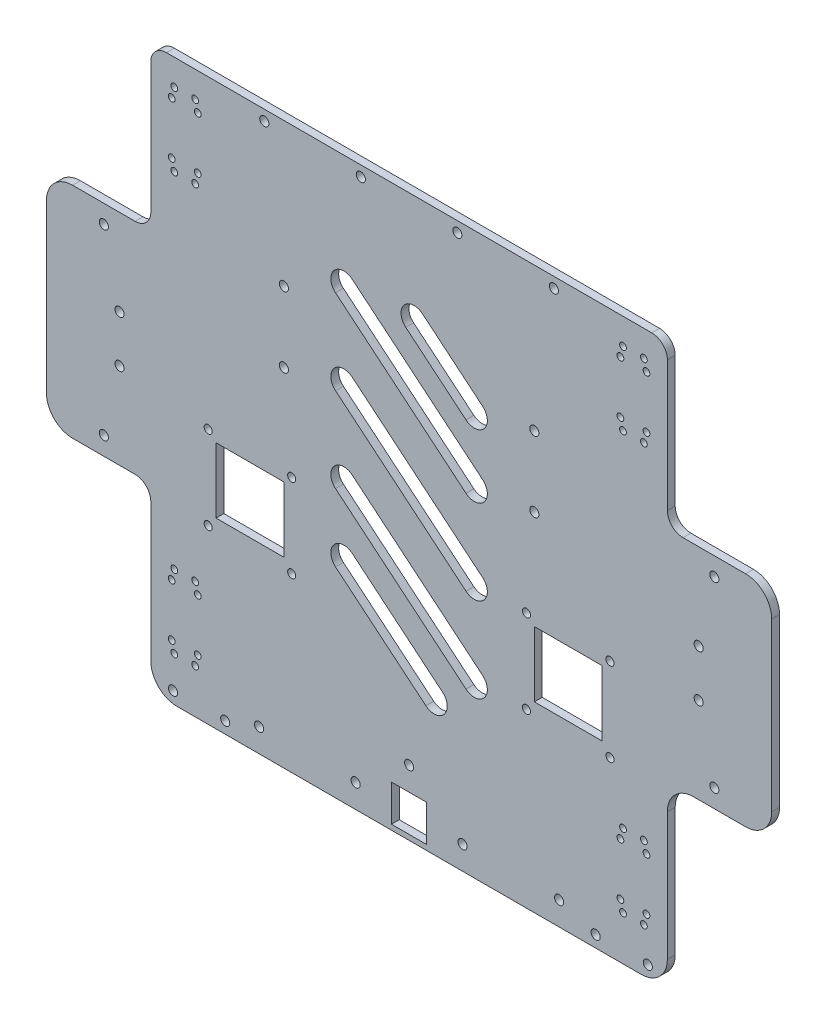
from build123d import *

# Parameters (mm, degrees)
SKETCH_1_W           = 278
SKETCH_1_H           = 210
EXTRUDE_1_DEPTH      = 3
SKETCH_2_W           = 40
SKETCH_2_H           = 62
SKETCH_2_H_2         = 64
CUT_EXTRUDE_1_DEPTH  = 3
SKETCH_3_R           = 1.2
CUT_EXTRUDE_2_DEPTH  = 3
SKETCH_5_R           = 1.3
CUT_EXTRUDE_4_DEPTH  = 3
SKETCH_7_R           = 1.75
CUT_EXTRUDE_5_DEPTH  = 3
SKETCH_8_W           = 198
SKETCH_8_H           = 5
EXTRUDE_2_DEPTH      = 3
SKETCH_9_R           = 1.75
SKETCH_9_W           = 13.5
SKETCH_9_H           = 14
CUT_EXTRUDE_6_DEPTH  = 3
SKETCH_11_R          = 1.75
CUT_EXTRUDE_7_DEPTH  = 3
SKETCH_12_R          = 1.55
SKETCH_12_W          = 26
SKETCH_12_H          = 25
CUT_EXTRUDE_8_DEPTH  = 3
FILLET_1_R           = 6
FILLET_2_R           = 6
FILLET_3_R           = 6
FILLET_4_R           = 10
FILLET_5_R           = 10
FILLET_6_R           = 6
FILLET_7_R           = 6
FILLET_8_R           = 10
FILLET_9_R           = 10
FILLET_10_R          = 10
FILLET_11_R          = 10
SKETCH_17_R          = 1.75
CUT_EXTRUDE_9_DEPTH  = 3
SKETCH_18_R          = 1.75
CUT_EXTRUDE_10_DEPTH = 3
SKETCH_22_R          = 1.75
CUT_EXTRUDE_11_DEPTH = 3
FILLET_12_R          = 10
SKETCH_23_R          = 1.3
CUT_EXTRUDE_12_DEPTH = 10
SKETCH_24_R          = 1.3
CUT_EXTRUDE_13_DEPTH = 10
SKETCH_25_R          = 1.75
CUT_EXTRUDE_14_DEPTH = 3
CUT_EXTRUDE_15_DEPTH = 178.285081155


with BuildPart() as part:
    # 草图1 → 凸台-拉伸1 (new body)
    with BuildSketch(Plane.XY):
        Rectangle(SKETCH_1_W, SKETCH_1_H)
    extrude(amount=EXTRUDE_1_DEPTH)

    # 草图2 → 切除-拉伸1 (cut)
    with BuildSketch(Plane.XY.offset(3)):
        with Locations((-119, 74)):
            Rectangle(SKETCH_2_W, SKETCH_2_H)
        with Locations((119, 74)):
            Rectangle(SKETCH_2_W, SKETCH_2_H)
        with Locations((-119, -73)):
            Rectangle(SKETCH_2_W, SKETCH_2_H_2)
        with Locations((119, -73)):
            Rectangle(SKETCH_2_W, SKETCH_2_H_2)
    extrude(amount=-CUT_EXTRUDE_1_DEPTH, mode=Mode.SUBTRACT)

    # 草图3 → 切除-拉伸2 (cut)
    with BuildSketch(Plane.XY.offset(3)):
        with Locations((-90, 95)):
            Circle(SKETCH_3_R)
        with Locations((-90, 67)):
            Circle(SKETCH_3_R)
        with Locations((-82, 95)):
            Circle(SKETCH_3_R)
        with Locations((-82, 67)):
            Circle(SKETCH_3_R)
        with Locations((82, 95)):
            Circle(SKETCH_3_R)
        with Locations((90, 95)):
            Circle(SKETCH_3_R)
        with Locations((90, 67)):
            Circle(SKETCH_3_R)
        with Locations((82, 67)):
            Circle(SKETCH_3_R)
    extrude(amount=-CUT_EXTRUDE_2_DEPTH, mode=Mode.SUBTRACT)

    # 草图5 → 切除-拉伸4 (cut)
    with BuildSketch(Plane.XY.offset(3)):
        with Locations((-90, -65)):
            Circle(SKETCH_5_R)
        with Locations((-90, -93)):
            Circle(SKETCH_5_R)
        with Locations((-82, -65)):
            Circle(SKETCH_5_R)
        with Locations((-82, -93)):
            Circle(SKETCH_5_R)
        with Locations((90, -65)):
            Circle(SKETCH_5_R)
        with Locations((82, -65)):
            Circle(SKETCH_5_R)
        with Locations((82, -93)):
            Circle(SKETCH_5_R)
        with Locations((90, -93)):
            Circle(SKETCH_5_R)
    extrude(amount=-CUT_EXTRUDE_4_DEPTH, mode=Mode.SUBTRACT)

    # 草图7 → 切除-拉伸5 (cut)
    with BuildSketch(Plane.XY.offset(3)):
        with Locations((-57.5, -101)):
            Circle(SKETCH_7_R)
        with Locations((-20.5, -101)):
            Circle(SKETCH_7_R)
        with Locations((20.5, -101)):
            Circle(SKETCH_7_R)
        with Locations((57.5, -101)):
            Circle(SKETCH_7_R)
    extrude(amount=-CUT_EXTRUDE_5_DEPTH, mode=Mode.SUBTRACT)

    # 草图8 → 凸台-拉伸2 (add)
    with BuildSketch(Plane.XY.offset(3)):
        with Locations((0, -107.5)):
            Rectangle(SKETCH_8_W, SKETCH_8_H)
    extrude(amount=-EXTRUDE_2_DEPTH)

    # 草图9 → 切除-拉伸6 (cut)
    with BuildSketch(Plane.XY.offset(3)):
        with Locations((0, -85)):
            Circle(SKETCH_9_R)
        with Locations((0, -101)):
            Rectangle(SKETCH_9_W, SKETCH_9_H)
    extrude(amount=-CUT_EXTRUDE_6_DEPTH, mode=Mode.SUBTRACT)

    # 草图11 → 切除-拉伸7 (cut)
    with BuildSketch(Plane.XY.offset(3)):
        with Locations((-55.5, 101)):
            Circle(SKETCH_11_R)
        with Locations((-18.5, 101)):
            Circle(SKETCH_11_R)
        with Locations((18.5, 101)):
            Circle(SKETCH_11_R)
        with Locations((55.5, 101)):
            Circle(SKETCH_11_R)
    extrude(amount=-CUT_EXTRUDE_7_DEPTH, mode=Mode.SUBTRACT)

    # 草图12 → 切除-拉伸8 (cut)
    with BuildSketch(Plane.XY.offset(3)):
        with Locations((-77, -12)):
            Circle(SKETCH_12_R)
        with Locations((-45, -12)):
            Circle(SKETCH_12_R)
        with Locations((-77, -44)):
            Circle(SKETCH_12_R)
        with Locations((-45, -44)):
            Circle(SKETCH_12_R)
        with Locations((45, -12)):
            Circle(SKETCH_12_R)
        with Locations((77, -12)):
            Circle(SKETCH_12_R)
        with Locations((45, -44)):
            Circle(SKETCH_12_R)
        with Locations((77, -44)):
            Circle(SKETCH_12_R)
        with Locations((-61, -27.5)):
            Rectangle(SKETCH_12_W, SKETCH_12_H)
        with Locations((61, -27.5)):
            Rectangle(SKETCH_12_W, SKETCH_12_H)
    extrude(amount=-CUT_EXTRUDE_8_DEPTH, mode=Mode.SUBTRACT)

    # 圆角1
    fillet_1_edges = [part.edges().sort_by_distance(p)[0] for p in [
        (-99, 105, 1.5),
    ]]
    fillet(fillet_1_edges, radius=FILLET_1_R)

    # 圆角2
    fillet_2_edges = [part.edges().sort_by_distance(p)[0] for p in [
        (99, 105, 1.5),
    ]]
    fillet(fillet_2_edges, radius=FILLET_2_R)

    # 圆角3
    fillet_3_edges = [part.edges().sort_by_distance(p)[0] for p in [
        (-99, 43, 1.5),
    ]]
    fillet(fillet_3_edges, radius=FILLET_3_R)

    # 圆角4
    fillet_4_edges = [part.edges().sort_by_distance(p)[0] for p in [
        (-139, 43, 1.5),
    ]]
    fillet(fillet_4_edges, radius=FILLET_4_R)

    # 圆角5
    fillet_5_edges = [part.edges().sort_by_distance(p)[0] for p in [
        (-139, -41, 1.5),
    ]]
    fillet(fillet_5_edges, radius=FILLET_5_R)

    # 圆角6
    fillet_6_edges = [part.edges().sort_by_distance(p)[0] for p in [
        (-99, -41, 1.5),
    ]]
    fillet(fillet_6_edges, radius=FILLET_6_R)

    # 圆角7
    fillet_7_edges = [part.edges().sort_by_distance(p)[0] for p in [
        (99, 43, 1.5),
    ]]
    fillet(fillet_7_edges, radius=FILLET_7_R)

    # 圆角8
    fillet_8_edges = [part.edges().sort_by_distance(p)[0] for p in [
        (139, 43, 1.5),
    ]]
    fillet(fillet_8_edges, radius=FILLET_8_R)

    # 圆角9
    fillet_9_edges = [part.edges().sort_by_distance(p)[0] for p in [
        (139, -41, 1.5),
    ]]
    fillet(fillet_9_edges, radius=FILLET_9_R)

    # 圆角10
    fillet_10_edges = [part.edges().sort_by_distance(p)[0] for p in [
        (-99, -110, 1.5),
    ]]
    fillet(fillet_10_edges, radius=FILLET_10_R)

    # 圆角11
    fillet_11_edges = [part.edges().sort_by_distance(p)[0] for p in [
        (99, -110, 1.5),
    ]]
    fillet(fillet_11_edges, radius=FILLET_11_R)

    # 草图17 → 切除-拉伸9 (cut)
    with BuildSketch(Plane.XY.offset(3)):
        with Locations((-117, 36)):
            Circle(SKETCH_17_R)
        with Locations((-111, 10)):
            Circle(SKETCH_17_R)
        with Locations((-111, -8)):
            Circle(SKETCH_17_R)
        with Locations((-117, -34)):
            Circle(SKETCH_17_R)
    extrude(amount=-CUT_EXTRUDE_9_DEPTH, mode=Mode.SUBTRACT)

    # 草图18 → 切除-拉伸10 (cut)
    with BuildSketch(Plane.XY.offset(3)):
        with Locations((111, 10)):
            Circle(SKETCH_18_R)
        with Locations((117, 36)):
            Circle(SKETCH_18_R)
        with Locations((111, -8)):
            Circle(SKETCH_18_R)
        with Locations((117, -34)):
            Circle(SKETCH_18_R)
    extrude(amount=-CUT_EXTRUDE_10_DEPTH, mode=Mode.SUBTRACT)

    # 草图22 → 切除-拉伸11 (cut)
    with BuildSketch(Plane.XY.offset(3)):
        with Locations((-90.484067519, -105.505527682)):
            Circle(SKETCH_22_R)
        with Locations((-70.484067519, -105.505527682)):
            Circle(SKETCH_22_R)
        with Locations((71.515932481, -105.505527682)):
            Circle(SKETCH_22_R)
        with Locations((91.515932481, -105.505527682)):
            Circle(SKETCH_22_R)
    extrude(amount=-CUT_EXTRUDE_11_DEPTH, mode=Mode.SUBTRACT)

    # 圆角12
    fillet_12_edges = [part.edges().sort_by_distance(p)[0] for p in [
        (99, -41, 1.5),
    ]]
    fillet(fillet_12_edges, radius=FILLET_12_R)

    # 草图23 → 切除-拉伸12 (cut)
    with BuildSketch(Plane.XY.offset(3)):
        with Locations((-91, 91)):
            Circle(SKETCH_23_R)
        with Locations((-91, 71)):
            Circle(SKETCH_23_R)
        with Locations((-81, 91)):
            Circle(SKETCH_23_R)
        with Locations((-81, 71)):
            Circle(SKETCH_23_R)
        with Locations((91, 91)):
            Circle(SKETCH_23_R)
        with Locations((81, 91)):
            Circle(SKETCH_23_R)
        with Locations((81, 71)):
            Circle(SKETCH_23_R)
        with Locations((91, 71)):
            Circle(SKETCH_23_R)
        with Locations((-91, -69)):
            Circle(SKETCH_23_R)
        with Locations((-91, -89)):
            Circle(SKETCH_23_R)
        with Locations((-81, -69)):
            Circle(SKETCH_23_R)
        with Locations((-81, -89)):
            Circle(SKETCH_23_R)
        with Locations((81, -69)):
            Circle(SKETCH_23_R)
        with Locations((91, -69)):
            Circle(SKETCH_23_R)
        with Locations((81, -89)):
            Circle(SKETCH_23_R)
        with Locations((91, -89)):
            Circle(SKETCH_23_R)
    extrude(amount=-CUT_EXTRUDE_12_DEPTH, mode=Mode.SUBTRACT)

    # 草图24 → 切除-拉伸13 (cut)
    with BuildSketch(Plane.XY.offset(3)):
        with Locations((-90, 95)):
            Circle(SKETCH_24_R)
        with Locations((-82, 95)):
            Circle(SKETCH_24_R)
        with Locations((-90, 67)):
            Circle(SKETCH_24_R)
        with Locations((-82, 67)):
            Circle(SKETCH_24_R)
        with Locations((82, 95)):
            Circle(SKETCH_24_R)
        with Locations((90, 95)):
            Circle(SKETCH_24_R)
        with Locations((82, 67)):
            Circle(SKETCH_24_R)
        with Locations((90, 67)):
            Circle(SKETCH_24_R)
    extrude(amount=-CUT_EXTRUDE_13_DEPTH, mode=Mode.SUBTRACT)

    # 草图25 → 切除-拉伸14 (cut)
    with BuildSketch(Plane.XY.offset(3)):
        with Locations((-48, 50)):
            Circle(SKETCH_25_R)
        with Locations((-48, 23)):
            Circle(SKETCH_25_R)
        with Locations((48, 50)):
            Circle(SKETCH_25_R)
        with Locations((48, 23)):
            Circle(SKETCH_25_R)
    extrude(amount=-CUT_EXTRUDE_14_DEPTH, mode=Mode.SUBTRACT)

    # 草图26 → 切除-拉伸15 (cut, through all)
    with BuildSketch(Plane(origin=(0, 0, 0), x_dir=(-1, 0, 0), z_dir=(0, 0, -1))):
        with BuildLine():
            Line((28.194855332, 57.686965468), (-21.805144668, 16.153846154))
            ThreePointArc((-21.805144668, 16.153846154), (-28.846153846, 16.805144668), (-28.194855332, 23.846153846))
            Line((-28.194855332, 23.846153846), (21.805144668, 65.379273161))
            ThreePointArc((21.805144668, 65.379273161), (28.846153846, 64.727974646), (28.194855332, 57.686965468))
        make_face()
        with BuildLine():
            Line((28.194855332, 25.186965468), (-21.805144668, -16.346153846))
            ThreePointArc((-21.805144668, -16.346153846), (-28.846153846, -15.694855332), (-28.194855332, -8.653846154))
            Line((-28.194855332, -8.653846154), (21.805144668, 32.879273161))
            ThreePointArc((21.805144668, 32.879273161), (28.846153846, 32.227974646), (28.194855332, 25.186965468))
        make_face()
        with BuildLine():
            Line((28.194855332, -7.313034532), (-21.805144668, -48.846153846))
            ThreePointArc((-21.805144668, -48.846153846), (-28.846153846, -48.194855332), (-28.194855332, -41.153846154))
            Line((-28.194855332, -41.153846154), (21.805144668, 0.379273161))
            ThreePointArc((21.805144668, 0.379273161), (28.846153846, -0.272025354), (28.194855332, -7.313034532))
        make_face()
        with BuildLine():
            Line((28.194855332, -33.313034532), (-6.420529283, -62.066732519))
            ThreePointArc((-6.420529283, -62.066732519), (-13.461538462, -61.415434004), (-12.810239947, -54.374424826))
            Line((-12.810239947, -54.374424826), (21.805144668, -25.620726839))
            ThreePointArc((21.805144668, -25.620726839), (28.846153846, -26.272025354), (28.194855332, -33.313034532))
        make_face()
        with BuildLine():
            Line((1.271778409, 59.679504865), (-21.805144668, 40.510372873))
            ThreePointArc((-21.805144668, 40.510372873), (-28.846153846, 41.161671388), (-28.194855332, 48.202680566))
            Line((-28.194855332, 48.202680566), (-5.117932255, 67.371812557))
            ThreePointArc((-5.117932255, 67.371812557), (1.923076923, 66.720514043), (1.271778409, 59.679504865))
        make_face()
    extrude(amount=-CUT_EXTRUDE_15_DEPTH, mode=Mode.SUBTRACT)


solid = part.part
